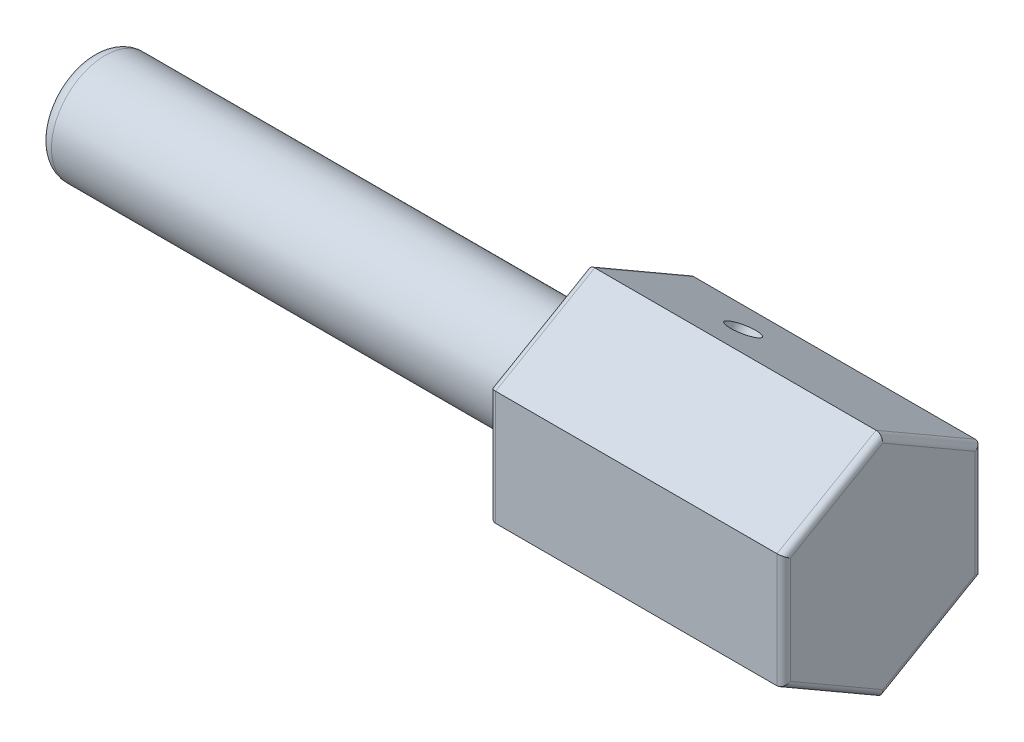
from build123d import *

# Parameters (mm, degrees)
CROQUIS1_R              = 4
SALIENTE_EXTRUIR1_DEPTH = 37.05
SALIENTE_EXTRUIR2_DEPTH = 22
REDONDEO1_R             = 0.5
REDONDEO2_R             = 1
CROQUIS3_R              = 1.1
CORTAR_EXTRUIR1_DEPTH   = 20


with BuildPart() as part:
    # Croquis1 → Saliente-Extruir1 (new body)
    with BuildSketch(Plane(origin=(0, 0, 0), x_dir=(0, 0, -1), z_dir=(1, 0, 0))):
        Circle(CROQUIS1_R)
    extrude(amount=SALIENTE_EXTRUIR1_DEPTH)

    # Croquis2 → Saliente-Extruir2 (add)
    with BuildSketch(Plane(origin=(37.05, 0, 0), x_dir=(0, 0, -1), z_dir=(1, 0, 0))):
        Polygon((0, -8.544783984), (7.4, -4.272391992), (7.4, 4.272391992), (0, 8.544783984), (-7.4, 4.272391992), (-7.4, -4.272391992), align=None)
    extrude(amount=SALIENTE_EXTRUIR2_DEPTH)

    # Redondeo1
    redondeo1_edges = [part.edges().sort_by_distance(p)[0] for p in [
        (37.05, 0, 4),
        (37.05, -6.408587988, 3.7),
        (37.05, -6.408587988, -3.7),
        (37.05, 0, -7.4),
        (37.05, 6.408587988, -3.7),
        (37.05, 6.408587988, 3.7),
        (37.05, 0, 7.4),
        (59.05, -6.408587988, 3.7),
        (59.05, -6.408587988, -3.7),
        (59.05, 0, -7.4),
        (59.05, 6.408587988, -3.7),
        (59.05, 6.408587988, 3.7),
        (59.05, 0, 7.4),
    ]]
    fillet(redondeo1_edges, radius=REDONDEO1_R)

    # Redondeo2
    redondeo2_edges = [part.edges().sort_by_distance(p)[0] for p in [
        (0, 0, 4),
    ]]
    fillet(redondeo2_edges, radius=REDONDEO2_R)

    # Croquis3 → Cortar-Extruir1 (cut)
    with BuildSketch(Plane(origin=(0, 6.408587988, -3.7), x_dir=(1, 0, 0), z_dir=(0, 0.8660254037844386, -0.5000000000000003))):
        with Locations(Location((44.925, 0, 0), (0, 0, 270))):
            Circle(CROQUIS3_R)
    extrude(amount=-CORTAR_EXTRUIR1_DEPTH, mode=Mode.SUBTRACT)


solid = part.part
